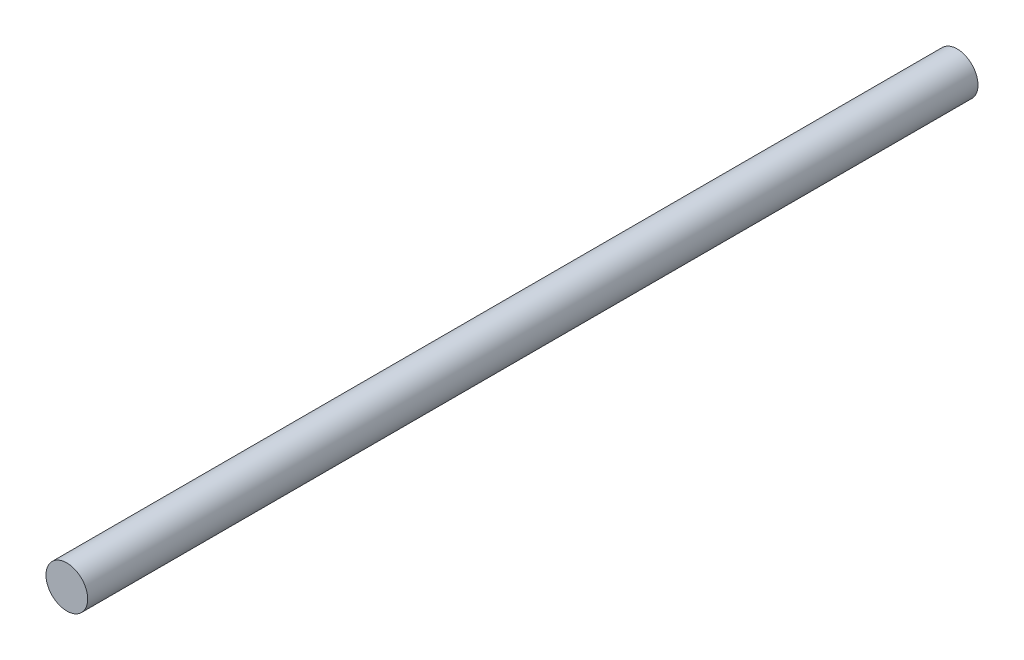
from build123d import *

# Parameters (mm, degrees)
SKETCH1_R           = 0.75
BOSS_EXTRUDE1_DEPTH = 32


with BuildPart() as part:
    # Sketch1 → Boss-Extrude1 (new body)
    with BuildSketch(Plane.XY):
        Circle(SKETCH1_R)
    extrude(amount=BOSS_EXTRUDE1_DEPTH)


solid = part.part
